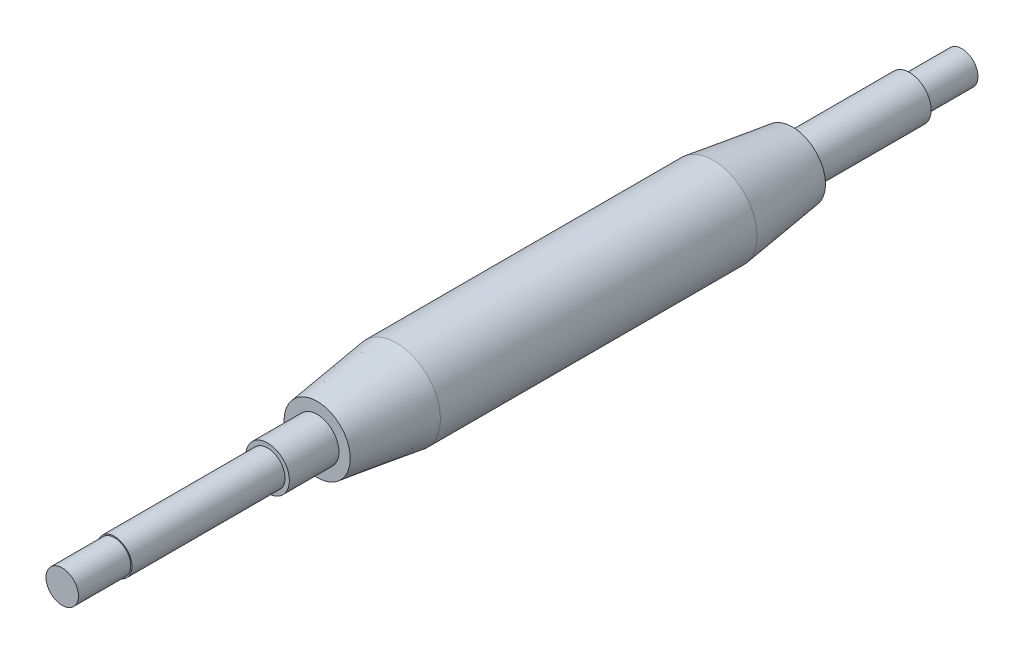
from build123d import *


with BuildPart() as part:
    # Esquisse1 → Base-Révolution (revolve)
    with BuildSketch(Plane(origin=(0, 0, 0), x_dir=(0, 0, -1), z_dir=(1, 0, 0)), mode=Mode.PRIVATE) as base_r_volution_sk:
        Polygon((27.8, 3.16), (27.8, 3.95), (36.8, 3.95), (36.8, 6), (51.2, 7.975), (108.7, 7.975), (123.1, 6), (123.1, 3.95), (144.35, 3.95), (144.35, 2.95), (153.85, 2.95), (153.85, 0), (-9.5, 0), (-9.5, 2.95), (0, 2.95), (0, 3.16), align=None)
    revolve(base_r_volution_sk.sketch.rotate(Axis((0, 0, 59.941388175), (0, 0, -1)), 90), axis=Axis((0, 0, 59.941388175), (0, 0, -1)))


solid = part.part
